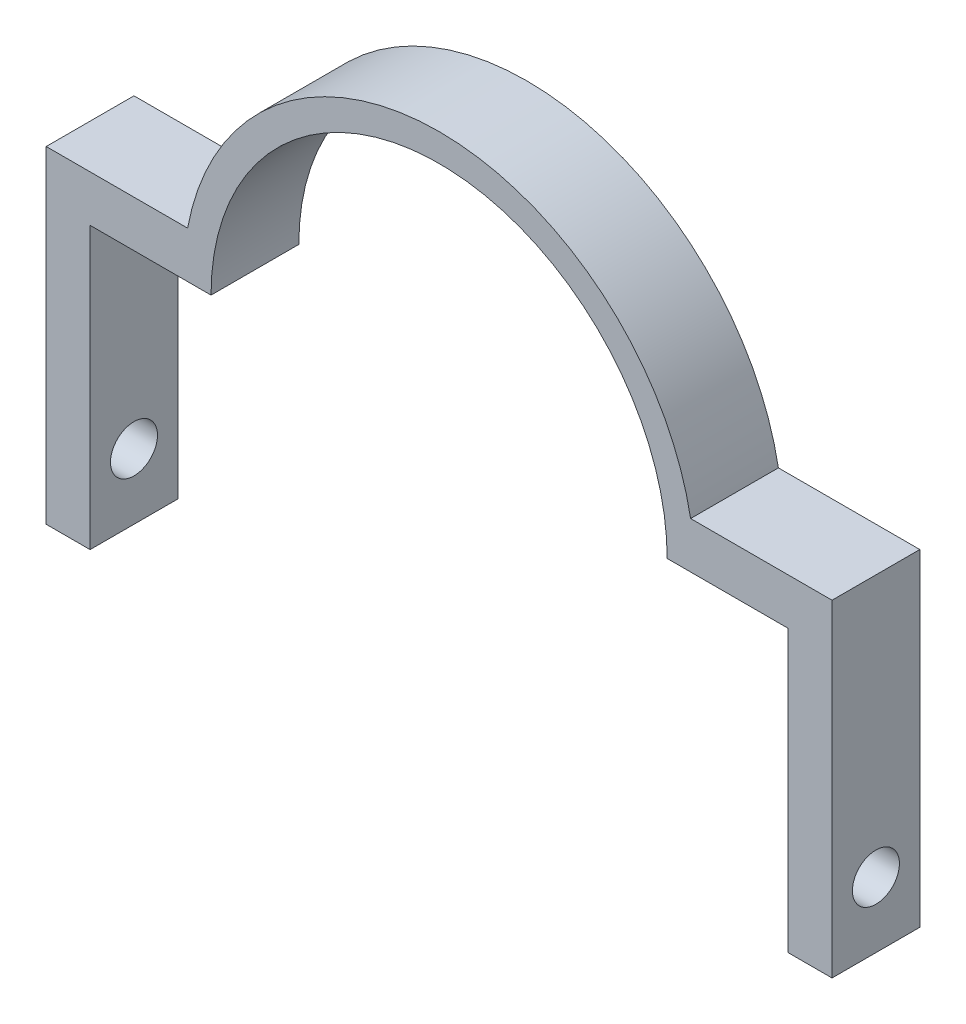
from build123d import *

# Parameters (mm, degrees)
BOSS_EXTRUDE1_DEPTH = 6.35
SKETCH2_R           = 1.700000029
CUT_EXTRUDE1_DEPTH  = 61.705405925


with BuildPart() as part:
    # Sketch1 → Boss-Extrude1 (new body)
    with BuildSketch(Plane.XY):
        with BuildLine():
            Line((-16.5, 0), (-25.2499952, 0))
            Line((-25.2499952, 0), (-25.2499952, -20.32))
            Line((-25.2499952, -20.32), (-28.4249952, -20.32))
            Line((-28.4249952, -20.32), (-28.4249952, 3.350143749))
            Line((-28.4249952, 3.350143749), (-18.194134683, 3.350143749))
            ThreePointArc((-18.194134683, 3.350143749), (0, 18.5), (18.194134683, 3.350143749))
            Line((18.194134683, 3.350143749), (28.4249952, 3.350143749))
            Line((28.4249952, 3.350143749), (28.4249952, -20.32))
            Line((28.4249952, -20.32), (25.2499952, -20.32))
            Line((25.2499952, -20.32), (25.2499952, 0))
            Line((25.2499952, 0), (16.5, 0))
            ThreePointArc((16.5, 0), (0, 16.5), (-16.5, 0))
        make_face()
    extrude(amount=BOSS_EXTRUDE1_DEPTH)

    # Sketch2 → Cut-Extrude1 (cut, through all)
    with BuildSketch(Plane(origin=(28.4249952, 0, 0), x_dir=(0, 0, -1), z_dir=(1, 0, 0))):
        with Locations(Location((-3.175, -15.587842251, 0), (0, 0, 90))):
            Circle(SKETCH2_R)
    extrude(amount=-CUT_EXTRUDE1_DEPTH, mode=Mode.SUBTRACT)


solid = part.part
